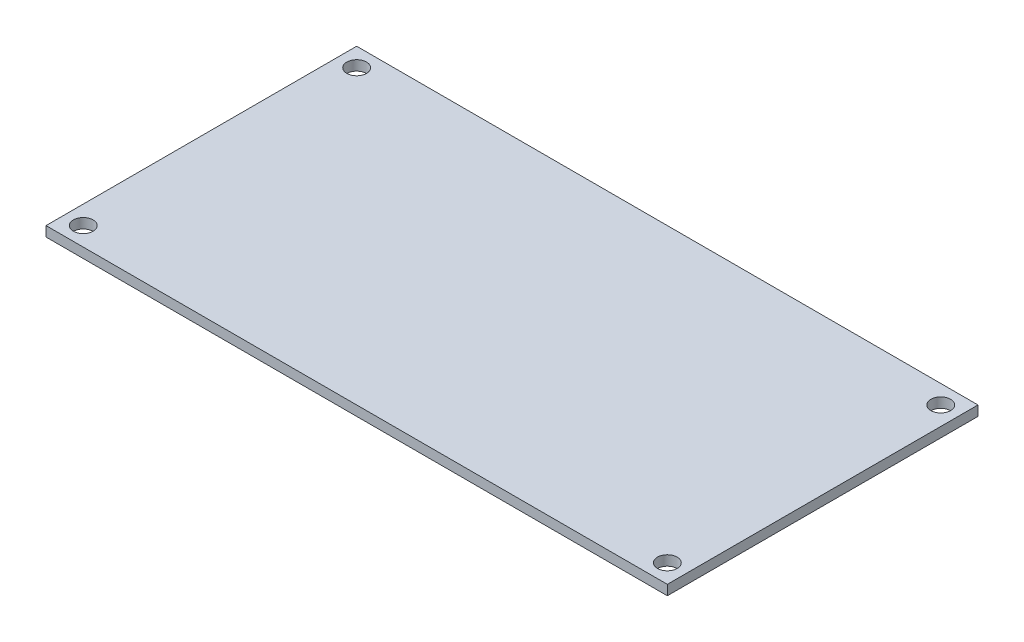
from build123d import *

# Parameters (mm, degrees)
SKETCH1_W           = 100
SKETCH1_H           = 50
SKETCH1_R           = 1.5875
BOSS_EXTRUDE1_DEPTH = 1.6


with BuildPart() as part:
    # Sketch1 → Boss-Extrude1 (new body)
    with BuildSketch(Plane(origin=(0, 0, 0), x_dir=(1, 0, 0), z_dir=(0, 1, 0))):
        with Locations((50, 25)):
            Rectangle(SKETCH1_W, SKETCH1_H)
        with Locations(Location((3, 47, 0), (0, 0, 270))):
            Circle(SKETCH1_R, mode=Mode.SUBTRACT)
        with Locations(Location((3, 3, 0), (0, 0, 270))):
            Circle(SKETCH1_R, mode=Mode.SUBTRACT)
        with Locations(Location((97, 3, 0), (0, 0, 270))):
            Circle(SKETCH1_R, mode=Mode.SUBTRACT)
        with Locations(Location((97, 47, 0), (0, 0, 270))):
            Circle(SKETCH1_R, mode=Mode.SUBTRACT)
    extrude(amount=BOSS_EXTRUDE1_DEPTH)


solid = part.part
